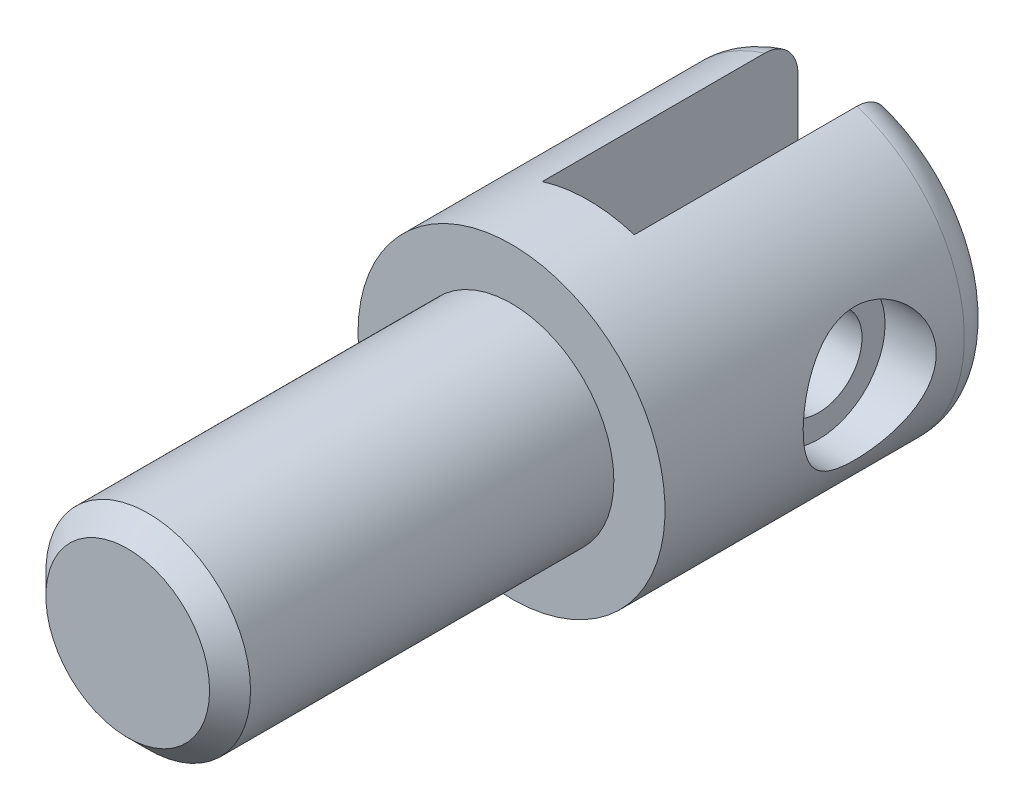
from build123d import *

# Parameters (mm, degrees)
ESQUISSE3_W                                        = 4
ESQUISSE3_H                                        = 15
CHANFREIN1_SIZE                                    = 0.8
ENL_V_MAT_EXTRU_3_DEPTH                            = 10
CHAMBRAGE_POUR_VIS_T_TE_HEXAGONALE_M31_D           = 3.4
CHAMBRAGE_POUR_VIS_T_TE_HEXAGONALE_M31_DEPTH       = 8
CHAMBRAGE_POUR_VIS_T_TE_HEXAGONALE_M31_CBORE_D     = 5.2
CHAMBRAGE_POUR_VIS_T_TE_HEXAGONALE_M31_CBORE_DEPTH = 3
CHAMBRAGE_POUR_VIS_T_TE_HEXAGONALE_M31_TIP         = 1.021463052
TROU_TARAUD_M31_D                                  = 2.5


with BuildPart() as part:
    # Esquisse1 → Base-Révolution (revolve)
    with BuildSketch(Plane(origin=(0, 0, 0), x_dir=(1, 0, 0), z_dir=(0, 1, 0))):
        with BuildLine():
            Line((0, 0), (6, 0))
            Line((6, 0), (6, 11.7))
            ThreePointArc((6, 11.7), (5.619238816, 12.619238816), (4.7, 13))
            Line((4.7, 13), (0, 13))
            Line((0, 13), (0, 0))
        make_face()
    revolve(axis=Axis((0, 0, 0), (0, 0, -1)))

    # Esquisse3 → Boss.-Révol.1 (revolve)
    with BuildSketch(Plane(origin=(0, 0, 0), x_dir=(1, 0, 0), z_dir=(0, 1, 0))):
        with Locations((2, -7.5)):
            Rectangle(ESQUISSE3_W, ESQUISSE3_H)
    revolve(axis=Axis((0, 0, 0), (0, 0, 1)))

    # Chanfrein1
    chanfrein1_edges = [part.edges().sort_by_distance(p)[0] for p in [
        (-4, 0, 15),
    ]]
    chamfer(chanfrein1_edges, length=CHANFREIN1_SIZE)

    # Esquisse2 → Enlèv. mat.-Extru.3 (cut)
    with BuildSketch(Plane.XY.offset(-13)):
        with BuildLine():
            Line((1.8, -5.723635209), (1.8, 5.723635209))
            ThreePointArc((1.8, 5.723635209), (0, 6), (-1.8, 5.723635209))
            Line((-1.8, 5.723635209), (-1.8, -5.723635209))
            ThreePointArc((-1.8, -5.723635209), (0, -6), (1.8, -5.723635209))
        make_face()
    extrude(amount=ENL_V_MAT_EXTRU_3_DEPTH, mode=Mode.SUBTRACT)

    # Chambrage pour vis à tête hexagonale M31
    with Locations(Plane(origin=(7, 0, 0), x_dir=(0, 0, -1), z_dir=(1, 0, 0))):
        with Locations((8, 0)):
            CounterBoreHole(CHAMBRAGE_POUR_VIS_T_TE_HEXAGONALE_M31_D / 2, CHAMBRAGE_POUR_VIS_T_TE_HEXAGONALE_M31_CBORE_D / 2, CHAMBRAGE_POUR_VIS_T_TE_HEXAGONALE_M31_CBORE_DEPTH, depth=CHAMBRAGE_POUR_VIS_T_TE_HEXAGONALE_M31_DEPTH)
            with Locations((0, 0, -(CHAMBRAGE_POUR_VIS_T_TE_HEXAGONALE_M31_DEPTH + CHAMBRAGE_POUR_VIS_T_TE_HEXAGONALE_M31_TIP / 2))):  # 118° drill point
                Cone(0, CHAMBRAGE_POUR_VIS_T_TE_HEXAGONALE_M31_D / 2, CHAMBRAGE_POUR_VIS_T_TE_HEXAGONALE_M31_TIP, mode=Mode.SUBTRACT)

    # Trou taraudé M31 (through all)
    with Locations(Plane(origin=(-1.8, 0, 0), x_dir=(0, 0, -1), z_dir=(1, 0, 0))):
        with Locations((8, 0)):
            Hole(TROU_TARAUD_M31_D / 2)


solid = part.part
